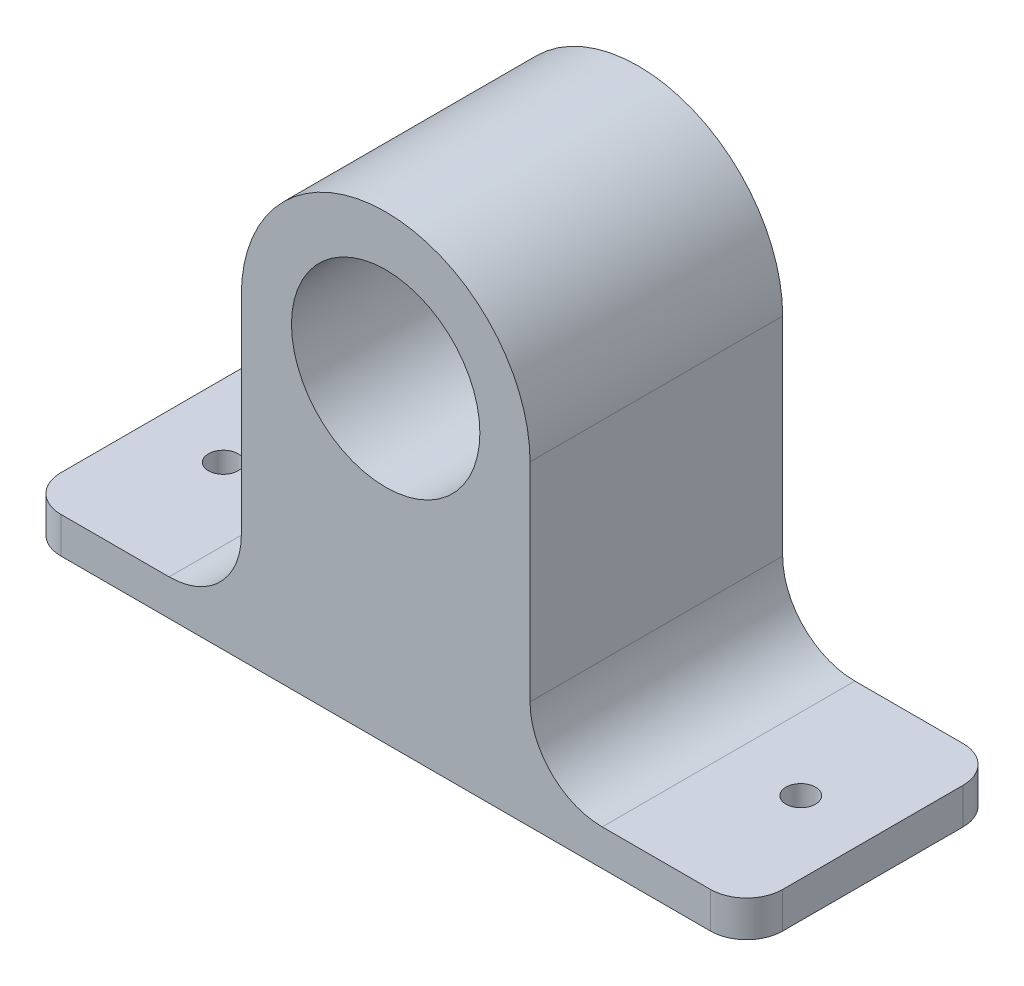
from build123d import *

# Parameters (mm, degrees)
CROQUIS1_R              = 13.05
SALIENTE_EXTRUIR1_DEPTH = 35
REDONDEO1_R             = 10
REDONDEO2_R             = 5
CROQUIS2_R              = 2.05
CORTAR_EXTRUIR1_DEPTH   = 85.749277283


with BuildPart() as part:
    # Croquis1 → Saliente-Extruir1 (new body)
    with BuildSketch(Plane.XY):
        with BuildLine():
            Line((-20, 2.5), (-20, 41.3))
            ThreePointArc((-20, 41.3), (0, 61.3), (20, 41.3))
            Line((20, 41.3), (20, 2.5))
            Line((20, 2.5), (50, 2.5))
            Line((50, 2.5), (50, -2.5))
            Line((50, -2.5), (-50, -2.5))
            Line((-50, -2.5), (-50, 2.5))
            Line((-50, 2.5), (-20, 2.5))
        make_face()
        with Locations((0, 41.3)):
            Circle(CROQUIS1_R, mode=Mode.SUBTRACT)
    extrude(amount=SALIENTE_EXTRUIR1_DEPTH)

    # Redondeo1
    redondeo1_edges = [part.edges().sort_by_distance(p)[0] for p in [
        (20, 2.5, 17.5),
        (-20, 2.5, 17.5),
    ]]
    fillet(redondeo1_edges, radius=REDONDEO1_R)

    # Redondeo2
    redondeo2_edges = [part.edges().sort_by_distance(p)[0] for p in [
        (50, 0, 0),
        (-50, 0, 0),
        (-50, 0, 35),
        (50, 0, 35),
    ]]
    fillet(redondeo2_edges, radius=REDONDEO2_R)

    # Croquis2 → Cortar-Extruir1 (cut, through all)
    with BuildSketch(Plane(origin=(0, 2.5, 0), x_dir=(1, 0, 0), z_dir=(0, 1, 0))):
        with Locations(Location((-40, -17.5, 0), (0, 0, 270))):
            Circle(CROQUIS2_R)
        with Locations(Location((40, -17.5, 0), (0, 0, 90))):
            Circle(CROQUIS2_R)
    extrude(amount=-CORTAR_EXTRUIR1_DEPTH, mode=Mode.SUBTRACT)


solid = part.part
